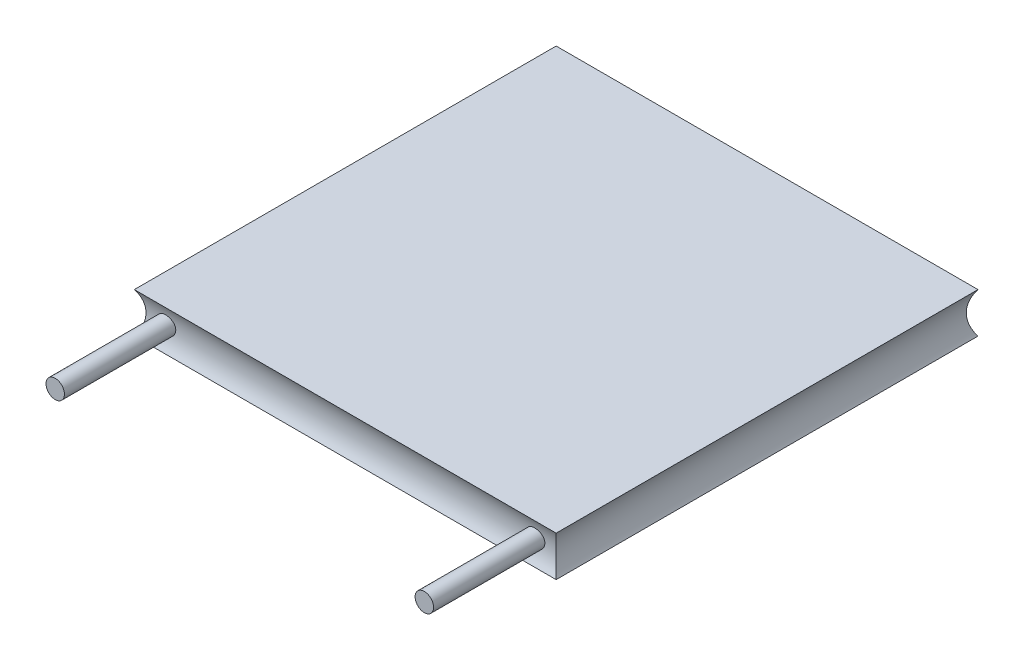
from build123d import *

# Parameters (mm, degrees)
SKETCH1_W                = 40
SKETCH1_H                = 40
BOSS_EXTRUDE1_DEPTH      = 3.82
CUT_EXTRUDE2_DEPTH       = 57.697375601
CUT_EXTRUDE5_DEPTH       = 45
BOSS_EXTRUDE2_DEPTH      = 10
BOSS_EXTRUDE2_DEPTH_BACK = 5
SKETCH4_R                = 0.875
BOSS_EXTRUDE3_DEPTH      = 10
BOSS_EXTRUDE3_DEPTH_BACK = 5
SKETCH5_R                = 0.875


with BuildPart() as part:
    # Sketch1 → Boss-Extrude1 (new body)
    with BuildSketch(Plane(origin=(0, 0, 0), x_dir=(1, 0, 0), z_dir=(0, 1, 0))):
        with Locations((20, 20)):
            Rectangle(SKETCH1_W, SKETCH1_H)
    extrude(amount=BOSS_EXTRUDE1_DEPTH)

    # Sketch2 → Cut-Extrude2 (cut, through all)
    with BuildSketch(Plane.XY):
        Polygon((-3, 1.91), (0, 1.91), (0, 3.82), align=None)
        with BuildLine():
            ThreePointArc((0, 3.82), (0.556416736, 1.91), (0, 0))
            Line((0, 0), (0, 3.82))
        make_face()
        Polygon((0, 0), (0, 1.91), (-3, 1.91), align=None)
        Polygon((40, 3.82), (40, 1.91), (43, 1.91), align=None)
        Polygon((43, 1.91), (40, 1.91), (40, 0), align=None)
        with BuildLine():
            ThreePointArc((40, 3.82), (39.443583264, 1.91), (40, 0))
            Line((40, 0), (40, 3.82))
        make_face()
    extrude(amount=-CUT_EXTRUDE2_DEPTH, mode=Mode.SUBTRACT)

    # Sketch3 → Cut-Extrude5 (cut)
    with BuildSketch(Plane(origin=(0, 0, 0), x_dir=(0, 0, -1), z_dir=(1, 0, 0))):
        with BuildLine():
            Line((40, 3.82), (43, 1.91))
            Line((43, 1.91), (40, 0))
            ThreePointArc((40, 0), (39.443583264, 1.91), (40, 3.82))
        make_face()
        with BuildLine():
            Line((0, 3.82), (-3, 1.91))
            Line((-3, 1.91), (0, 0))
            ThreePointArc((0, 0), (0.556416736, 1.91), (0, 3.82))
        make_face()
    extrude(amount=CUT_EXTRUDE5_DEPTH, mode=Mode.SUBTRACT)

    # Sketch4 → Boss-Extrude2 (add, two sides: drawn at the far end of the back side and taken through both)
    with BuildSketch(Plane.XY.offset(-BOSS_EXTRUDE2_DEPTH_BACK)):
        with Locations((2.5, 1.91)):
            Circle(SKETCH4_R)
    extrude(amount=BOSS_EXTRUDE2_DEPTH + BOSS_EXTRUDE2_DEPTH_BACK)

    # Sketch5 → Boss-Extrude3 (add, two sides: drawn at the far end of the back side and taken through both)
    with BuildSketch(Plane.XY.offset(-BOSS_EXTRUDE3_DEPTH_BACK)):
        with Locations((37.5, 1.91)):
            Circle(SKETCH5_R)
    extrude(amount=BOSS_EXTRUDE3_DEPTH + BOSS_EXTRUDE3_DEPTH_BACK)


solid = part.part
